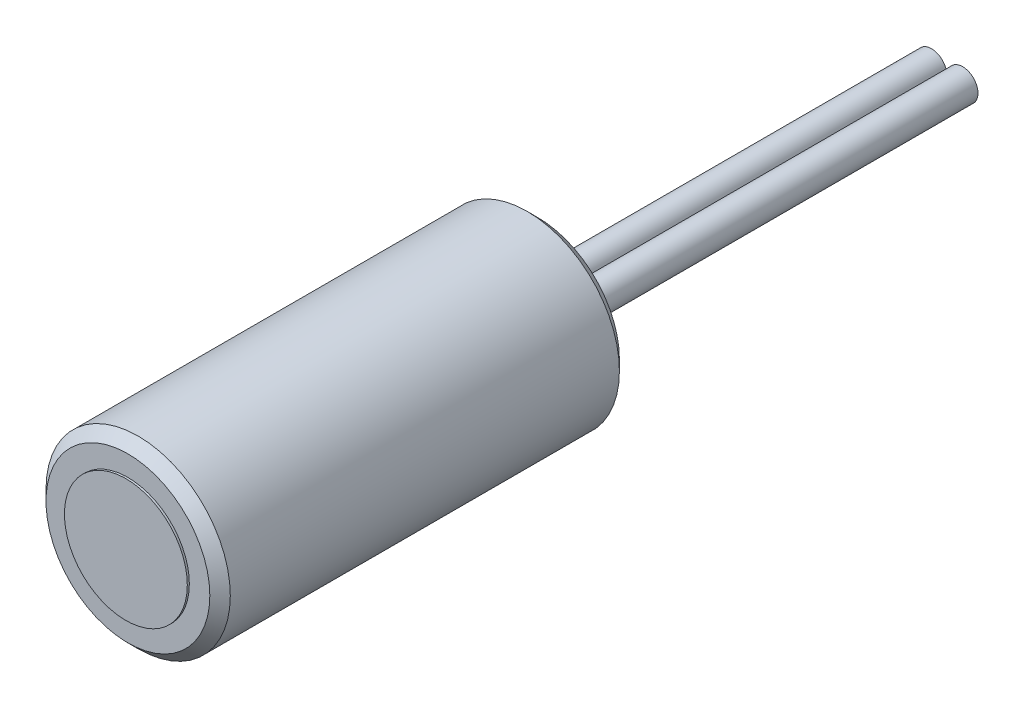
from build123d import *

# Parameters (mm, degrees)
ESQUISSE2_R        = 4.5
BOSS_EXTRU_1_DEPTH = 20
CHANFREIN1_SIZE    = 0.5
ESQUISSE3_R        = 3
BOSS_EXTRU_4_DEPTH = 0.1
ESQUISSE5_R        = 0.75
BOSS_EXTRU_5_DEPTH = 20


with BuildPart() as part:
    # Esquisse2 → Boss.-Extru.1 (new body)
    with BuildSketch(Plane.XY):
        Circle(ESQUISSE2_R)
    extrude(amount=BOSS_EXTRU_1_DEPTH)

    # Chanfrein1
    chanfrein1_edges = [part.edges().sort_by_distance(p)[0] for p in [
        (-4.5, 0, 0),
        (-4.5, 0, 20),
    ]]
    chamfer(chanfrein1_edges, length=CHANFREIN1_SIZE)

    # Esquisse3 → Boss.-Extru.4 (add)
    with BuildSketch(Plane.XY.offset(20)):
        Circle(ESQUISSE3_R)
    extrude(amount=BOSS_EXTRU_4_DEPTH)

    # Esquisse5 → Boss.-Extru.5 (add)
    with BuildSketch(Plane(origin=(0, 0, 0), x_dir=(-1, 0, 0), z_dir=(0, 0, -1))):
        with Locations(Location((0.76, 0, 0), (0, 0, 180))):
            Circle(ESQUISSE5_R)
        with Locations(Location((-0.76, 0, 0), (0, 0, 180))):
            Circle(ESQUISSE5_R)
    extrude(amount=BOSS_EXTRU_5_DEPTH)


solid = part.part
